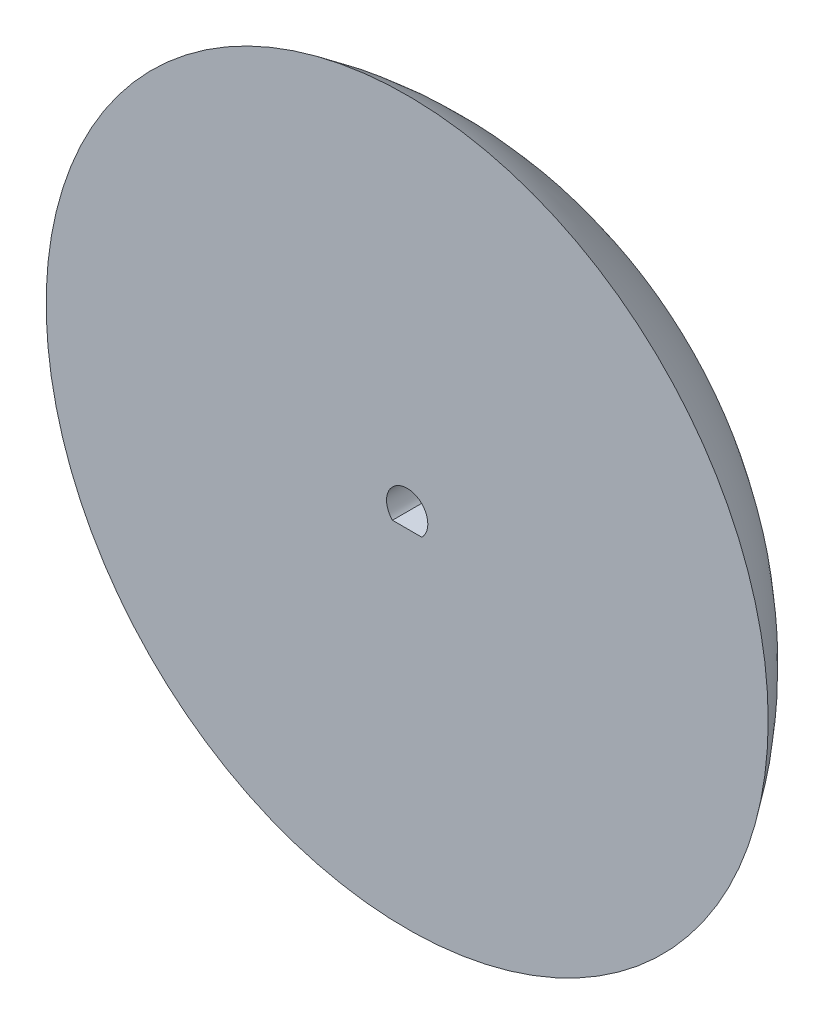
from build123d import *

# Parameters (mm, degrees)
CUT_EXTRUDE_1_DEPTH = 10.1


with BuildPart() as part:
    # Эскиз1 → Повернуть1 (revolve)
    with BuildSketch(Plane(origin=(0, 0, 0), x_dir=(0, 0, -1), z_dir=(1, 0, 0)), mode=Mode.PRIVATE) as revolve_1_sk:
        with BuildLine():
            Line((15, 7), (15, 0))
            Line((15, 0), (0, 0))
            Line((0, 0), (0, 35))
            ThreePointArc((0, 35), (11.013776325, 22.882380174), (15, 7))
        make_face()
    revolve(revolve_1_sk.sketch.rotate(Axis((0, 0, 81.764660039), (0, 0, -1)), 90), axis=Axis((0, 0, 81.764660039), (0, 0, -1)))

    # Эскиз2 → Вырез-Вытянуть1 (cut)
    with BuildSketch(Plane.XY):
        with BuildLine():
            Line((-1.428285686, -1.4), (1.428285686, -1.4))
            ThreePointArc((1.428285686, -1.4), (0, 2), (-1.428285686, -1.4))
        make_face()
    extrude(amount=-CUT_EXTRUDE_1_DEPTH, mode=Mode.SUBTRACT)


solid = part.part
